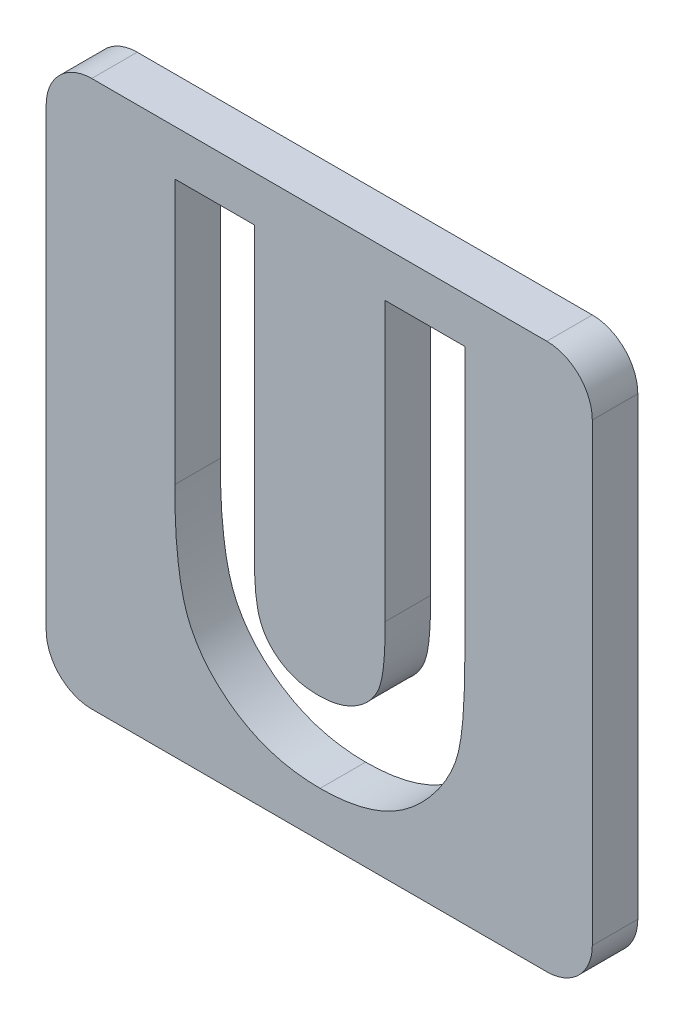
from build123d import *

# Parameters (mm, degrees)
BOSS_EXTRUDE1_DEPTH = 10
CUT_EXTRUDE34_DEPTH = 10


with BuildPart() as part:
    # Sketch1 → Boss-Extrude1 (new body)
    with BuildSketch(Plane.XY):
        with BuildLine():
            Line((-50, 60), (50, 60))
            ThreePointArc((50, 60), (57.071067812, 57.071067812), (60, 50))
            Line((60, 50), (60, -50))
            ThreePointArc((60, -50), (57.071067812, -57.071067812), (50, -60))
            Line((50, -60), (-50, -60))
            ThreePointArc((-50, -60), (-57.071067812, -57.071067812), (-60, -50))
            Line((-60, -50), (-60, 50))
            ThreePointArc((-60, 50), (-57.071067812, 57.071067812), (-50, 60))
        make_face()
    extrude(amount=BOSS_EXTRUDE1_DEPTH)

    # Sketch2 → Cut-Extrude34 (cut)
    with BuildSketch(Plane.XY.offset(10)):
        with BuildLine():
            Line((-31.75, 50), (-14.25, 50))
            Line((-14.25, 50), (-14.25, -13.4375))
            add(Edge.make_bspline(
                [(-14.25, -13.4375), (-14.249048436, -14.095192485), (-14.247210501, -15.365518725), (-14.155202495, -17.18802097), (-14.071008825, -18.863282124), (-13.919099547, -20.389468135), (-13.694677475, -21.767231851), (-13.477363681, -23.005423537), (-13.183250949, -24.081874769), (-12.741246534, -25.307158094), (-12.060262829, -26.683830835), (-10.947573238, -28.118630748), (-9.663624637, -29.428093921), (-8.124738289, -30.518041453), (-6.395166126, -31.399710765), (-4.484411381, -32.052930153), (-2.395167537, -32.416033402), (-0.950570024, -32.471467764), (-0.20703125, -32.5)],
                knots=[0, 0, 0, 0, 1.155499968, 2.231836252, 3.205919964, 4.102923608, 4.924856345, 5.658536265, 6.31071849, 6.882491295, 7.94666036, 8.992281882, 10.060072772, 11.158554251, 12.289267114, 13.461410017, 14.693379945, 16, 16, 16, 16], degree=3))
            add(Edge.make_bspline(
                [(-0.20703125, -32.5), (0.58288694, -32.476949616), (2.123093674, -32.432005269), (4.338435864, -31.990827854), (6.390962967, -31.288322317), (8.237215984, -30.285667879), (9.875357596, -29.083810814), (11.262010144, -27.713317134), (12.356351241, -26.171453388), (13.069602054, -24.748966669), (13.470057261, -23.439691518), (13.770218387, -22.269903853), (13.990269699, -20.8896702), (14.189907481, -19.320545885), (14.309874409, -17.5462778), (14.439958985, -15.58113484), (14.487636189, -13.411670971), (14.495762421, -11.901032563), (14.5, -11.11328125)],
                knots=[0, 0, 0, 0, 1.261321664, 2.459363699, 3.594844139, 4.716940403, 5.803436589, 6.833651888, 7.818396249, 8.814403945, 9.360733334, 10.004355033, 10.743453831, 11.592799886, 12.532235708, 13.585170094, 14.740740724, 16, 16, 16, 16], degree=3))
            Line((14.5, -11.11328125), (14.5, 50))
            Line((14.5, 50), (32, 50))
            Line((32, 50), (32, -8.1640625))
            add(Edge.make_bspline(
                [(32, -8.1640625), (31.997569807, -9.342463626), (31.992896783, -11.608414067), (31.921133218, -14.86474431), (31.768361569, -17.838879649), (31.640051007, -20.531689117), (31.391726127, -22.939545056), (31.133029856, -25.072729698), (30.803299203, -26.923683518), (30.312679818, -29.030769504), (29.466016005, -31.45700185), (28.101082939, -34.250703218), (26.368388756, -36.985906082), (24.320430824, -39.632521321), (22.008098987, -42.091141586), (19.48266259, -44.249491939), (16.78424454, -46.075223595), (13.884648303, -47.523695215), (10.786341582, -48.653393883), (7.458668947, -49.412494488), (3.903899606, -49.925352385), (1.448553234, -49.974618698), (0.18359375, -50)],
                knots=[0, 0, 0, 0, 1.170808336, 2.251350247, 3.235597562, 4.129743112, 4.929140599, 5.639994148, 6.264258765, 6.79612947, 7.788252245, 8.809469599, 9.879094798, 10.999557536, 12.129761673, 13.226370002, 14.293821979, 15.358369427, 16.438775801, 17.562147481, 18.744053101, 20, 20, 20, 20], degree=3))
            add(Edge.make_bspline(
                [(0.18359375, -50), (-0.656870496, -49.98584349), (-2.315089212, -49.957912986), (-4.753790735, -49.711638896), (-7.111274811, -49.34872349), (-9.383111744, -48.819267286), (-11.577186656, -48.13530876), (-13.692916631, -47.293403446), (-15.722439107, -46.298247386), (-17.65439716, -45.158993863), (-19.486413351, -43.927087294), (-21.160781583, -42.561467005), (-22.735120796, -41.163125773), (-24.163948989, -39.673215464), (-25.457997932, -38.107377594), (-26.614602531, -36.462063463), (-27.632044456, -34.737419211), (-28.535916899, -32.902358231), (-29.309543493, -30.863610995), (-29.961739774, -28.548658425), (-30.531513794, -25.921215951), (-30.954936225, -22.975364085), (-31.338813488, -19.720812027), (-31.581786631, -16.149081171), (-31.708896819, -12.260069041), (-31.735952739, -9.563897555), (-31.75, -8.1640625)],
                knots=[0, 0, 0, 0, 1.001158378, 1.975264943, 2.917723546, 3.841610987, 4.75185031, 5.653588123, 6.552117133, 7.442167995, 8.324307438, 9.179605724, 10.014504199, 10.831958861, 11.636465792, 12.43274043, 13.225645099, 14.020104002, 14.867201867, 15.819789774, 16.883317127, 18.068162734, 19.364263498, 20.787406516, 22.332041935, 24, 24, 24, 24], degree=3))
            Line((-31.75, -8.1640625), (-31.75, 50))
        make_face()
    extrude(amount=-CUT_EXTRUDE34_DEPTH, mode=Mode.SUBTRACT)


solid = part.part
